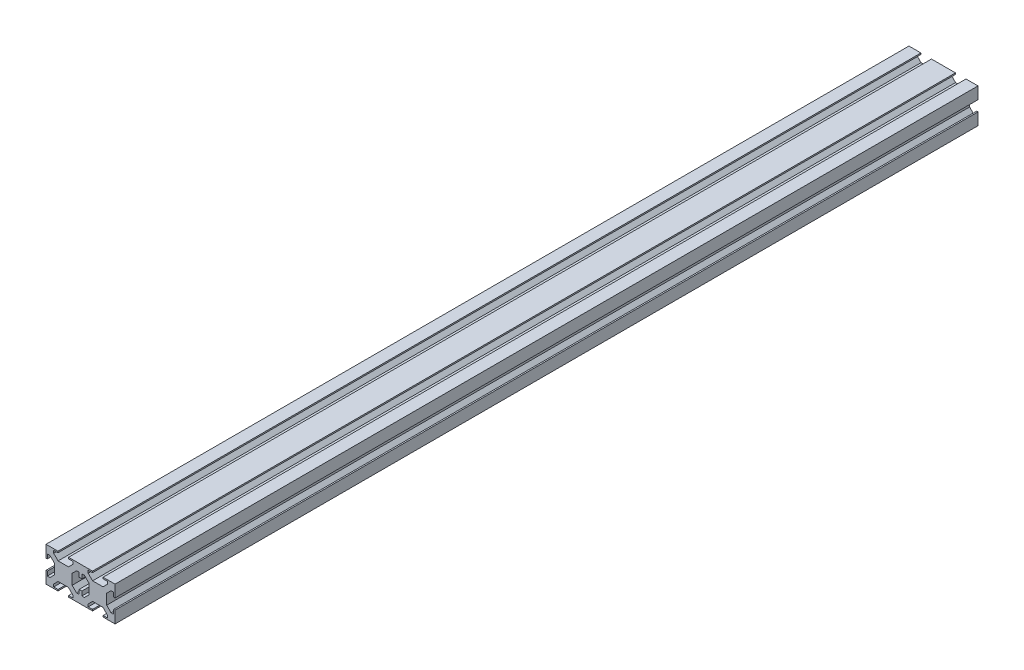
from build123d import *

# Parameters (mm, degrees)
EXTRUDE_1_DEPTH = 500


with BuildPart() as part:
    # 草图1 → 凸台-拉伸1 (new body)
    with BuildSketch(Plane.XY):
        Polygon((-10, -3.05), (-10, -10), (-3.05, -10), (-3.05, -9.2), (-5.55, -9.2), (-5.55, -7.7), (-3, -5.15), (3, -5.15), (5.55, -7.7), (5.55, -9.2), (3.05, -9.2), (3.05, -10), (16.95, -10), (16.95, -9.2), (14.45, -9.2), (14.45, -7.7), (17, -5.15), (23, -5.15), (25.55, -7.7), (25.55, -9.2), (23.05, -9.2), (23.05, -10), (30, -10), (30, -3.05), (29.2, -3.05), (29.2, -5.55), (27.7, -5.55), (25.15, -3), (25.15, 3), (27.7, 5.55), (29.2, 5.55), (29.2, 3.05), (30, 3.05), (30, 10), (23.05, 10), (23.05, 9.2), (25.55, 9.2), (25.55, 7.7), (23, 5.15), (17, 5.15), (14.45, 7.7), (14.45, 9.2), (16.95, 9.2), (16.95, 10), (3.05, 10), (3.05, 9.2), (5.55, 9.2), (5.55, 7.7), (3, 5.15), (-3, 5.15), (-5.55, 7.7), (-5.55, 9.2), (-3.05, 9.2), (-3.05, 10), (-10, 10), (-10, 3.05), (-9.2, 3.05), (-9.2, 5.55), (-7.7, 5.55), (-5.15, 3), (-5.15, -3), (-7.7, -5.55), (-9.2, -5.55), (-9.2, -3.05), align=None)
        Polygon((9.2, 3.05), (10, 3.05), (10.8, 3.05), (10.8, 5.55), (12.3, 5.55), (14.85, 3), (14.85, -3), (12.3, -5.55), (10.8, -5.55), (10.8, -3.05), (10, -3.05), (9.2, -3.05), (9.2, -5.55), (7.7, -5.55), (5.15, -3), (5.15, 3), (7.7, 5.55), (9.2, 5.55), align=None, mode=Mode.SUBTRACT)
    extrude(amount=EXTRUDE_1_DEPTH)


solid = part.part
